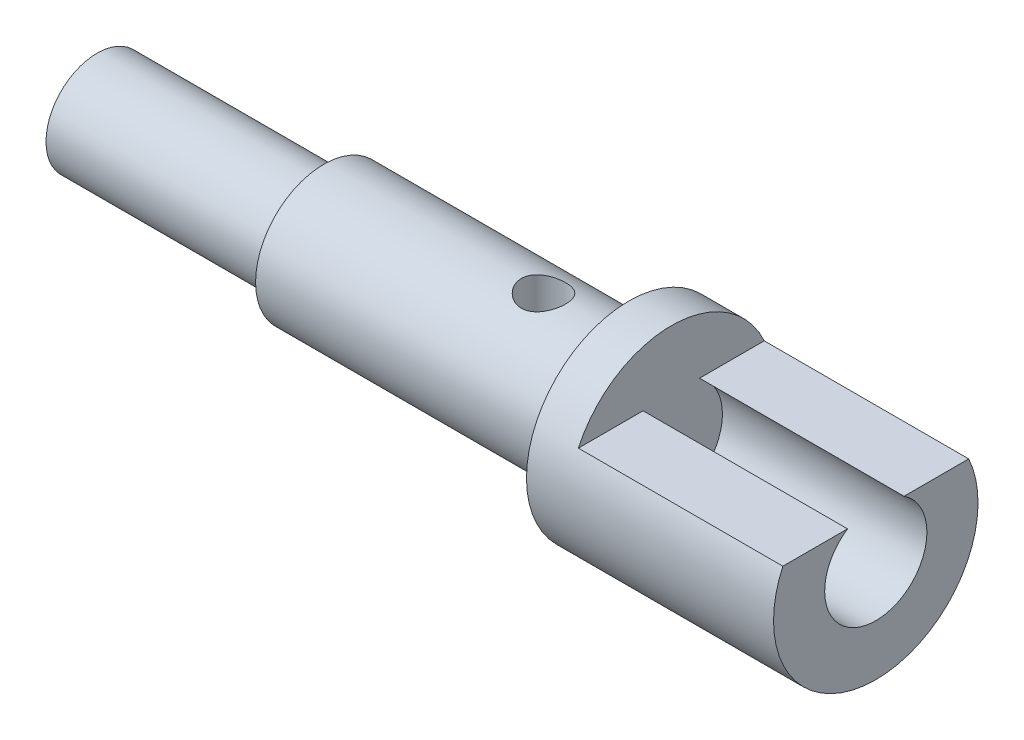
from build123d import *

# Parameters (mm, degrees)
SKETCH_1_R               = 6
EXTRUDE_1_DEPTH          = 45.7
CUT_EXTRUDE_START        = -12
CUT_EXTRUDE_1_DEPTH      = 12
SKETCH_3_OUTSIDE_W       = 23.75
SKETCH_3_OUTSIDE_H       = 23.75
SKETCH_3_OUTSIDE_R       = 4
CUT_EXTRUDE_2_DEPTH      = 31.2
SKETCH_4_OUTSIDE_W       = 23.75
SKETCH_4_OUTSIDE_H       = 23.75
SKETCH_4_OUTSIDE_R       = 3
CUT_EXTRUDE_3_DEPTH      = 13.3
CUT_EXTRUDE_4_DEPTH      = 47.481071416
CUT_EXTRUDE_4_DEPTH_BACK = 47.481071416
SKETCH_5_R               = 1.3


with BuildPart() as part:
    # ｽｹｯﾁ1 → ﾎﾞｽ - 押し出し1 (new body)
    with BuildSketch(Plane(origin=(0, 0, 0), x_dir=(0, 0, -1), z_dir=(1, 0, 0))):
        with Locations(Location((0, 0, 0), (0, 0, 180))):
            Circle(SKETCH_1_R)
    extrude(amount=EXTRUDE_1_DEPTH)

    # ｽｹｯﾁ2 → ｶｯﾄ - 押し出し1 (cut)
    with BuildSketch(Plane(origin=(45.7, 0, 0), x_dir=(0, 0, -1), z_dir=(1, 0, 0)).offset(CUT_EXTRUDE_START)):
        with BuildLine():
            ThreePointArc((5.454356057, 2.5), (0, 6), (-5.454356057, 2.5))
            Line((-5.454356057, 2.5), (-1.658312395, 2.5))
            ThreePointArc((-1.658312395, 2.5), (0, -3), (1.658312395, 2.5))
            Line((1.658312395, 2.5), (5.454356057, 2.5))
        make_face()
    extrude(amount=CUT_EXTRUDE_1_DEPTH, mode=Mode.SUBTRACT)

    # ｽｹｯﾁ3 outside → ｶｯﾄ - 押し出し2 (cut)
    with BuildSketch(Plane.ZY):
        Rectangle(SKETCH_3_OUTSIDE_W, SKETCH_3_OUTSIDE_H)
        Circle(SKETCH_3_OUTSIDE_R, mode=Mode.SUBTRACT)
    extrude(amount=-CUT_EXTRUDE_2_DEPTH, mode=Mode.SUBTRACT)

    # ｽｹｯﾁ4 outside → ｶｯﾄ - 押し出し3 (cut)
    with BuildSketch(Plane.ZY):
        Rectangle(SKETCH_4_OUTSIDE_W, SKETCH_4_OUTSIDE_H)
        Circle(SKETCH_4_OUTSIDE_R, mode=Mode.SUBTRACT)
    extrude(amount=-CUT_EXTRUDE_3_DEPTH, mode=Mode.SUBTRACT)

    # ｽｹｯﾁ5 → ｶｯﾄ - 押し出し4 (cut, two sides: drawn at the far end of the back side and taken through both)
    with BuildSketch(Plane(origin=(0, 0, 0), x_dir=(1, 0, 0), z_dir=(0, 1, 0)).offset(-CUT_EXTRUDE_4_DEPTH_BACK)):
        with Locations(Location((26.2, 0, 0), (0, 0, 270))):
            Circle(SKETCH_5_R)
    extrude(amount=CUT_EXTRUDE_4_DEPTH + CUT_EXTRUDE_4_DEPTH_BACK, mode=Mode.SUBTRACT)


solid = part.part
